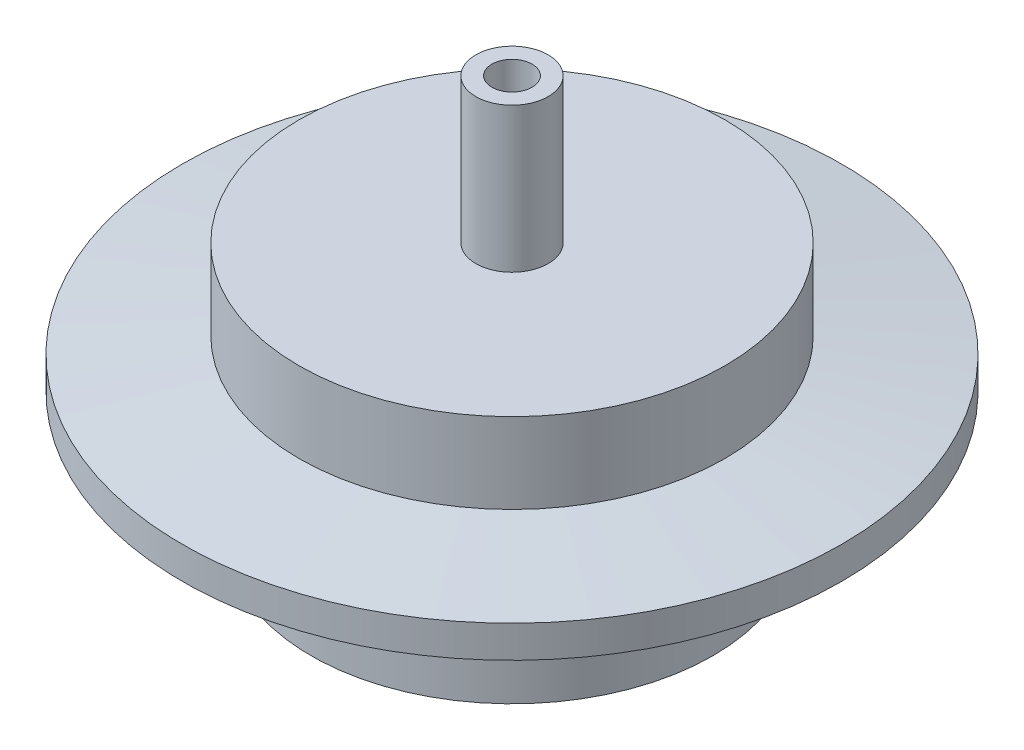
from build123d import *


with BuildPart() as part:
    # Sketch1 → Revolve1 (revolve)
    with BuildSketch(Plane.XY):
        Polygon((0, 0), (0, -9), (-11, -9), (-11, -14), (-18.25, -15), (-18.25, -17), (-10.25, -17), (-10.25, -25), (-8.25, -25), (-8.25, -14), (1, -14), (1, 0), align=None)
    revolve(axis=Axis((2.25, 0, 0), (0, -1, 0)))


solid = part.part
